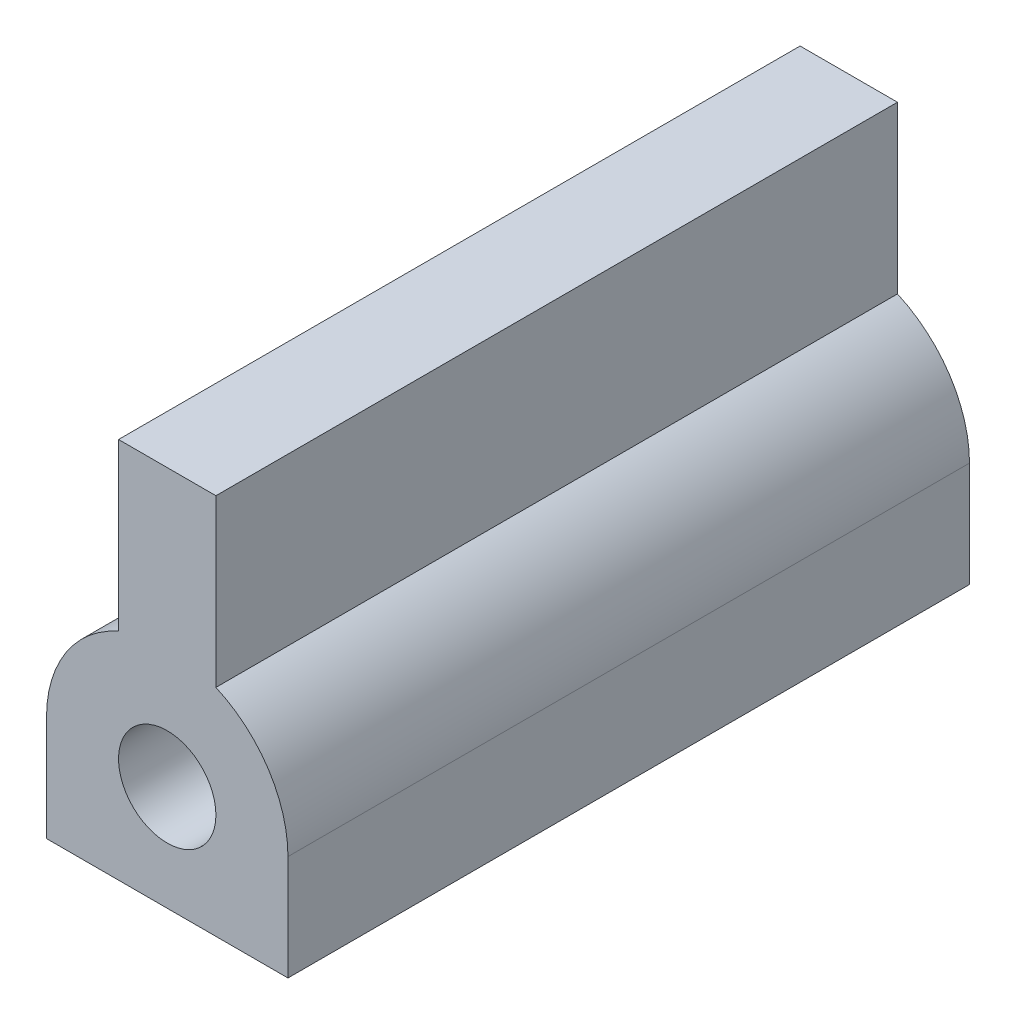
from build123d import *

# Parameters (mm, degrees)
SKETCH1_R           = 3.175
BOSS_EXTRUDE1_DEPTH = 22.225


with BuildPart() as part:
    # Sketch1 → Boss-Extrude1 (new, symmetric)
    with BuildSketch(Plane.XY):
        with BuildLine():
            Line((7.874, -6.858), (-7.874, -6.858))
            Line((-7.874, -6.858), (-7.874, 0))
            ThreePointArc((-7.874, 0), (-6.595446384, 4.301158332), (-3.175, 7.20550144))
            Line((-3.175, 7.20550144), (-3.175, 18.034))
            Line((-3.175, 18.034), (3.175, 18.034))
            Line((3.175, 18.034), (3.175, 7.20550144))
            ThreePointArc((3.175, 7.20550144), (6.595446384, 4.301158332), (7.874, 0))
            Line((7.874, 0), (7.874, -6.858))
        make_face()
        Circle(SKETCH1_R, mode=Mode.SUBTRACT)
    extrude(amount=BOSS_EXTRUDE1_DEPTH, both=True)


solid = part.part
